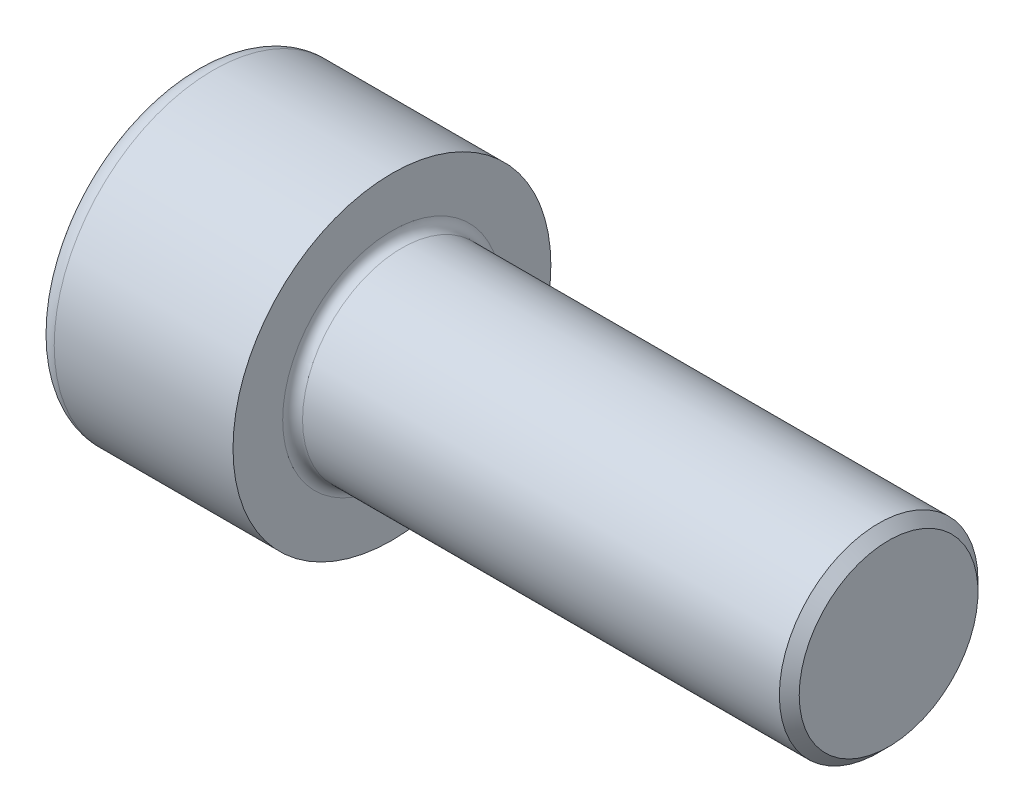
from build123d import *

# Parameters (mm, degrees)
CORTAR_EXTRUIR1_DEPTH = 5
REDONDEO1_R           = 1
REDONDEO2_R           = 0.5
CHAFL_N1_SIZE         = 0.5


with BuildPart() as part:
    # Croquis1 → Revolución1 (revolve)
    with BuildSketch(Plane.XY, mode=Mode.PRIVATE) as revoluci_n1_sk:
        Polygon((0, 0), (0, 8), (10, 8), (10, 5), (35, 5), (35, 0), align=None)
    revolve(revoluci_n1_sk.sketch.rotate(Axis((0, 0, 0), (1, 0, 0)), 90), axis=Axis((0, 0, 0), (1, 0, 0)))

    # Croquis2 → Cortar-Extruir1 (cut)
    with BuildSketch(Plane.ZY):
        Polygon((0, 4.618802154), (-4, 2.309401077), (-4, -2.309401077), (0, -4.618802154), (4, -2.309401077), (4, 2.309401077), align=None)
    extrude(amount=-CORTAR_EXTRUIR1_DEPTH, mode=Mode.SUBTRACT)

    # Redondeo1
    redondeo1_edges = [part.edges().sort_by_distance(p)[0] for p in [
        (0, 0, -8),
    ]]
    fillet(redondeo1_edges, radius=REDONDEO1_R)

    # Redondeo2
    redondeo2_edges = [part.edges().sort_by_distance(p)[0] for p in [
        (10, 0, -5),
    ]]
    fillet(redondeo2_edges, radius=REDONDEO2_R)

    # Chaflán1
    chafl_n1_edges = [part.edges().sort_by_distance(p)[0] for p in [
        (35, 0, -5),
    ]]
    chamfer(chafl_n1_edges, length=CHAFL_N1_SIZE)


solid = part.part
